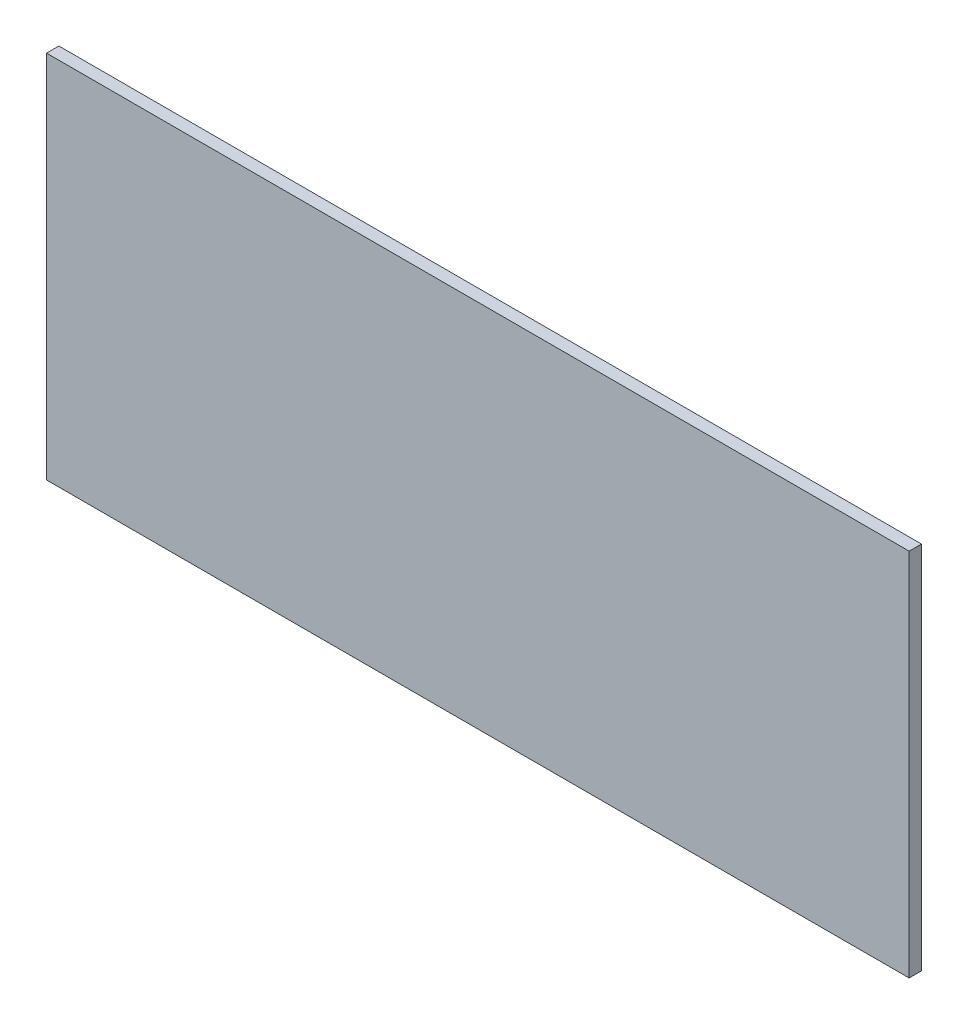
from build123d import *

# Parameters (mm, degrees)
SKETCH1_W           = 177.8
SKETCH1_H           = 76.2
BOSS_EXTRUDE1_DEPTH = 2.54


with BuildPart() as part:
    # Sketch1 → Boss-Extrude1 (new body)
    with BuildSketch(Plane.XY):
        with Locations((-0.202894562, -26.68784411)):
            Rectangle(SKETCH1_W, SKETCH1_H)
    extrude(amount=-BOSS_EXTRUDE1_DEPTH)


solid = part.part
